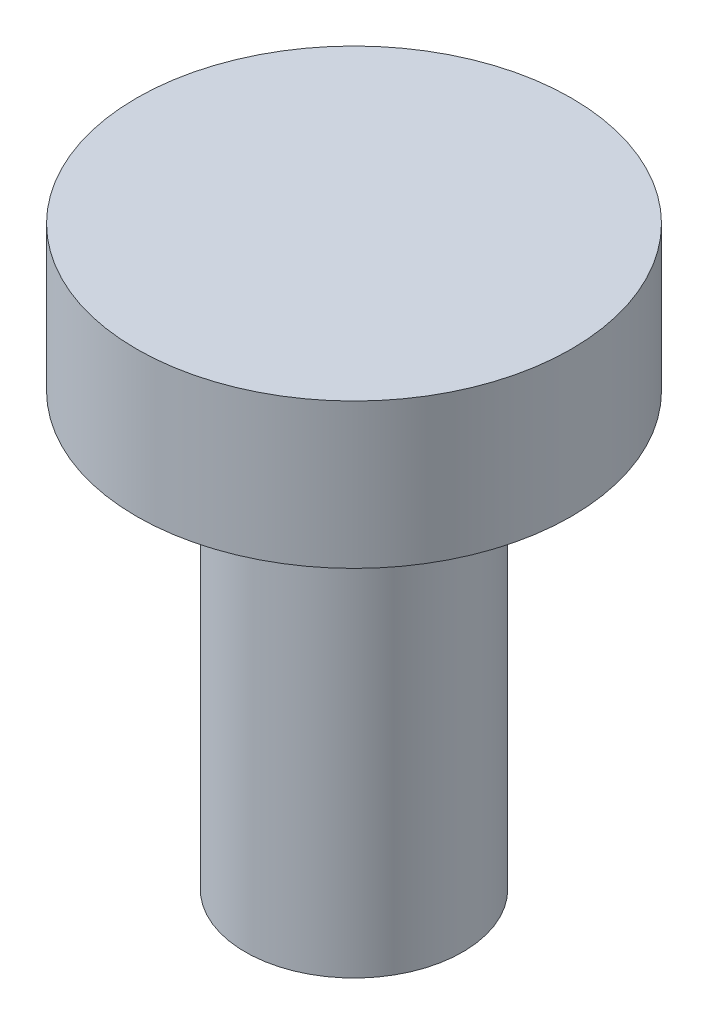
from build123d import *

# Parameters (mm, degrees)
SKETCH1_W = 1.5
SKETCH1_H = 5.955517261


with BuildPart() as part:
    # Sketch1 → Revolve1 (revolve)
    with BuildSketch(Plane.XY, mode=Mode.PRIVATE) as revolve1_sk:
        Polygon((0, 7.955517261), (0, 5.955517261), (1.5, 5.955517261), (3, 5.955517261), (3, 7.955517261), align=None)
        with Locations((0.75, 2.977758631)):
            Rectangle(SKETCH1_W, SKETCH1_H)
    revolve(revolve1_sk.sketch.rotate(Axis((0, 5.955517261, 0), (0, 1, 0)), 90), axis=Axis((0, 5.955517261, 0), (0, 1, 0)))


solid = part.part
